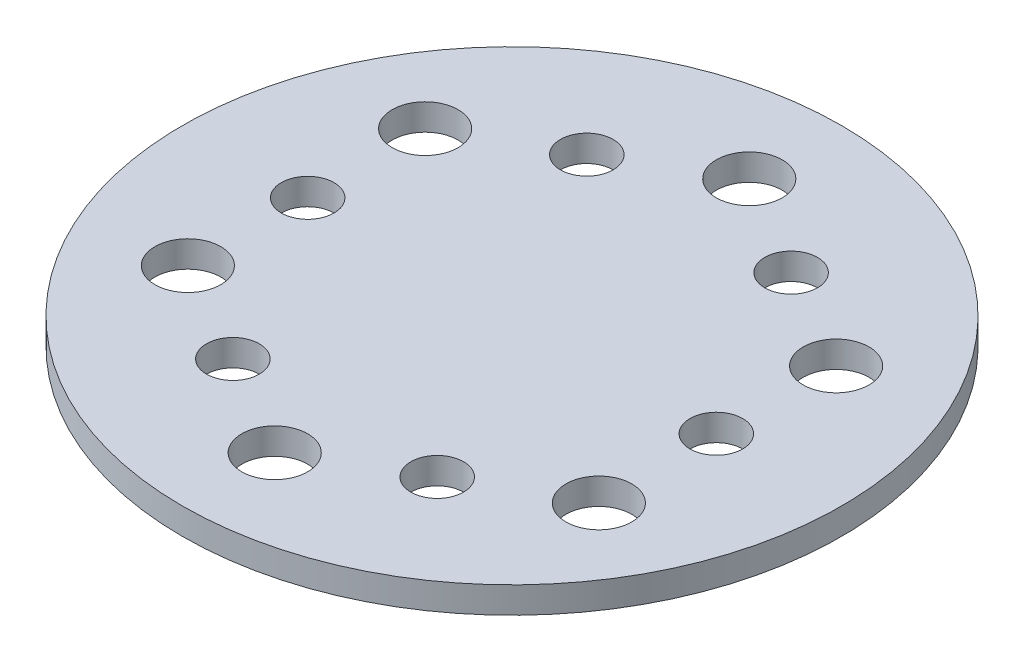
from build123d import *

# Parameters (mm, degrees)
SKETCH_1_R          = 25
EXTRUDE_1_DEPTH     = 2
SKETCH_2_R          = 2.5
SKETCH_2_R_2        = 2
CUT_EXTRUDE_1_DEPTH = 2


with BuildPart() as part:
    # Эскиз1 → Бобышка-Вытянуть1 (new body)
    with BuildSketch(Plane(origin=(0, 0, 0), x_dir=(1, 0, 0), z_dir=(0, 1, 0))):
        with Locations(Location((0, 0, 0), (0, 0, 270))):
            Circle(SKETCH_1_R)
    extrude(amount=EXTRUDE_1_DEPTH)

    # Эскиз2 → Вырез-Вытянуть1 (cut)
    with BuildSketch(Plane(origin=(0, 2, 0), x_dir=(1, 0, 0), z_dir=(0, 1, 0))):
        with Locations(Location((0, 18, 0), (0, 0, 270))):
            Circle(SKETCH_2_R)
        with Locations(Location((15.588457268, 9, 0), (0, 0, 270))):
            Circle(SKETCH_2_R)
        with Locations(Location((15.588457268, -9, 0), (0, 0, 270))):
            Circle(SKETCH_2_R)
        with Locations(Location((0, -18, 0), (0, 0, 270))):
            Circle(SKETCH_2_R)
        with Locations(Location((-15.588457268, -9, 0), (0, 0, 270))):
            Circle(SKETCH_2_R)
        with Locations(Location((-15.588457268, 9, 0), (0, 0, 270))):
            Circle(SKETCH_2_R)
        with Locations(Location((-15.5, 0, 0), (0, 0, 270))):
            Circle(SKETCH_2_R_2)
        with Locations(Location((-7.75, 13.423393759, 0), (0, 0, 270))):
            Circle(SKETCH_2_R_2)
        with Locations(Location((7.75, 13.423393759, 0), (0, 0, 270))):
            Circle(SKETCH_2_R_2)
        with Locations(Location((15.5, 0, 0), (0, 0, 270))):
            Circle(SKETCH_2_R_2)
        with Locations(Location((7.75, -13.423393759, 0), (0, 0, 270))):
            Circle(SKETCH_2_R_2)
        with Locations(Location((-7.75, -13.423393759, 0), (0, 0, 270))):
            Circle(SKETCH_2_R_2)
    extrude(amount=-CUT_EXTRUDE_1_DEPTH, mode=Mode.SUBTRACT)


solid = part.part
